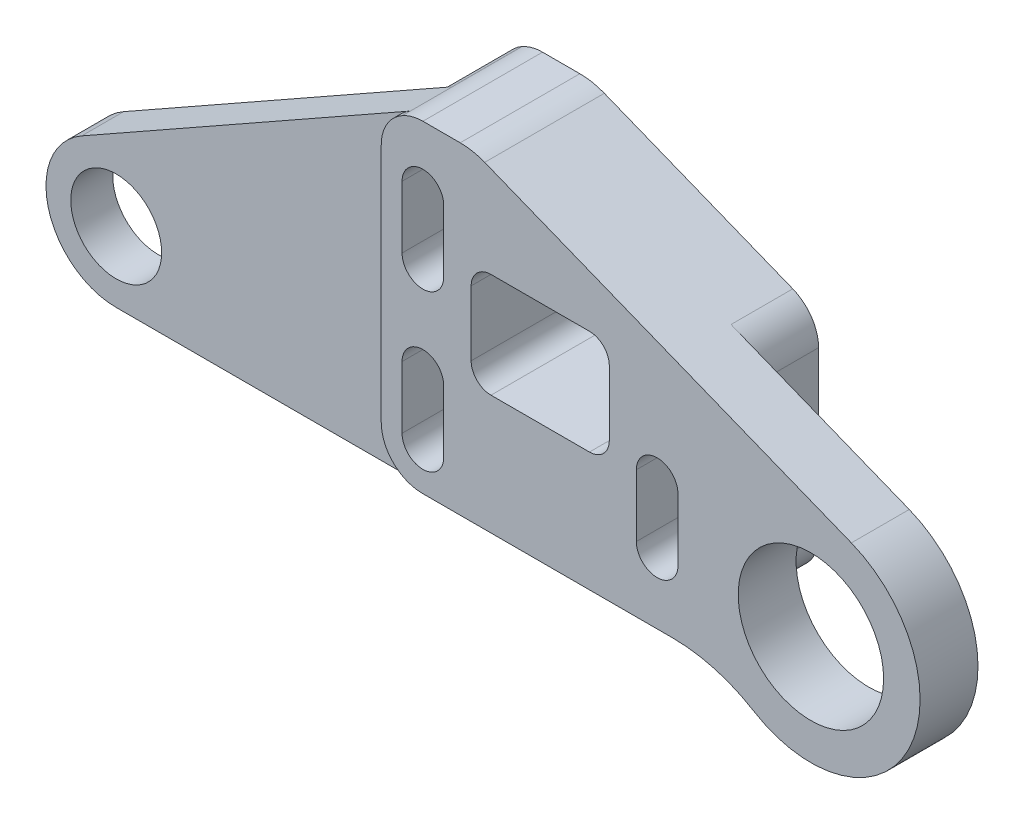
from build123d import *

# Parameters (mm, degrees)
BASE_EXTRUDE_DEPTH = 22.987
CUT_EXTRUDE1_DEPTH = 1.524
CUT_EXTRUDE2_START = -13.3858
CUT_EXTRUDE2_DEPTH = 13.3858
CUT_EXTRUDE3_DEPTH = 11.8618
SKETCH5_R          = 8.73125
CUT_EXTRUDE4_DEPTH = 165.748162847
SKETCH6_R          = 13.97
CUT_EXTRUDE5_DEPTH = 165.9536267
CUT_EXTRUDE6_DEPTH = 165.9536267


with BuildPart() as part:
    # Sketch1 → Base-Extrude (new body)
    with BuildSketch(Plane.XY):
        with BuildLine():
            Line((67.622164121, 48.488607139), (60.451998121, 48.488607139))
            ThreePointArc((60.451998121, 48.488607139), (58.415767784, 48.225162891), (56.513628913, 47.45217869))
            Line((56.513628913, 47.45217869), (-6.63896207, 11.740278591))
            ThreePointArc((-6.63896207, 11.740278591), (-13.04330848, -3.432500932), (0, -13.4874))
            Line((0, -13.4874), (108.3963288, -13.4874))
            ThreePointArc((108.3963288, -13.4874), (116.52844195, -14.610715729), (124.051506942, -17.896533077))
            ThreePointArc((124.051506942, -17.896533077), (153.760306668, -9.394598854), (142.773406597, 19.487639521))
            Line((142.773406597, 19.487639521), (72.327100379, 47.584944713))
            ThreePointArc((72.327100379, 47.584944713), (70.017630202, 48.26064561), (67.622164121, 48.488607139))
        make_face()
    extrude(amount=BASE_EXTRUDE_DEPTH)

    # Sketch2 → Cut-Extrude1 (cut)
    with BuildSketch(Plane.XY.offset(22.987)):
        with BuildLine():
            Line((52.451, 40.561691476), (52.451, -5.6134))
            ThreePointArc((52.451, -5.6134), (54.757241386, -11.181158976), (60.325000513, -13.4874))
            Line((60.325000513, -13.4874), (60.325000513, -28.150605259))
            Line((60.325000513, -28.150605259), (-23.486257356, -28.150605259))
            Line((-23.486257356, -28.150605259), (-22.173444803, 52.159193632))
            Line((-22.173444803, 52.159193632), (56.513628913, 52.159193632))
            Line((56.513628913, 52.159193632), (56.513628913, 47.45217869))
            Line((56.513628913, 47.45217869), (56.449146437, 47.415714759))
            ThreePointArc((56.449146437, 47.415714759), (53.523590332, 44.529146898), (52.451, 40.561691476))
        make_face()
    extrude(amount=-CUT_EXTRUDE1_DEPTH, mode=Mode.SUBTRACT)

    # Sketch3 → Cut-Extrude2 (cut)
    with BuildSketch(Plane(origin=(0, 0, 0), x_dir=(-1, 0, 0), z_dir=(0, 0, -1)).offset(CUT_EXTRUDE2_START)):
        with BuildLine():
            Line((-52.451, 40.561691476), (-52.451, -5.6134))
            ThreePointArc((-52.451, -5.6134), (-54.757241386, -11.181158976), (-60.325000513, -13.4874))
            Line((-60.325000513, -13.4874), (-60.325000513, -35.585726692))
            Line((-60.325000513, -35.585726692), (18.461929403, -35.585726692))
            Line((18.461929403, -35.585726692), (18.461929403, 62.437610527))
            Line((18.461929403, 62.437610527), (-56.449146437, 62.437610527))
            Line((-56.449146437, 62.437610527), (-56.449146437, 47.415714759))
            ThreePointArc((-56.449146437, 47.415714759), (-53.523590332, 44.529146898), (-52.451, 40.561691476))
        make_face()
    extrude(amount=CUT_EXTRUDE2_DEPTH, mode=Mode.SUBTRACT)

    # Sketch4 → Cut-Extrude3 (cut)
    with BuildSketch(Plane(origin=(0, 0, 0), x_dir=(-1, 0, 0), z_dir=(0, 0, -1))):
        with BuildLine():
            Line((-113.4872, -5.6134), (-113.4872, 25.831689784))
            ThreePointArc((-113.4872, 25.831689784), (-112.131206016, 30.249321907), (-108.530259798, 33.145419212))
            Line((-108.530259798, 33.145419212), (-119.346107198, 60.263197686))
            Line((-119.346107198, 60.263197686), (-162.925004358, 60.263197686))
            Line((-162.925004358, 60.263197686), (-162.925004358, -25.739632552))
            Line((-162.925004358, -25.739632552), (-105.6132, -25.739632552))
            Line((-105.6132, -25.739632552), (-105.6132, -13.4874))
            ThreePointArc((-105.6132, -13.4874), (-111.180958795, -11.181158795), (-113.4872, -5.6134))
        make_face()
    extrude(amount=-CUT_EXTRUDE3_DEPTH, mode=Mode.SUBTRACT)

    # Sketch5 → Cut-Extrude4 (cut, through all)
    with BuildSketch(Plane.XY.offset(21.463)):
        Circle(SKETCH5_R)
    extrude(amount=-CUT_EXTRUDE4_DEPTH, mode=Mode.SUBTRACT)

    # Sketch6 → Cut-Extrude5 (cut, through all)
    with BuildSketch(Plane.XY.offset(22.987)):
        with Locations((135.000853225, 8.827e-05)):
            Circle(SKETCH6_R)
    extrude(amount=-CUT_EXTRUDE5_DEPTH, mode=Mode.SUBTRACT)

    # Sketch7 → Cut-Extrude6 (cut, through all)
    with BuildSketch(Plane.XY.offset(22.987)):
        with BuildLine():
            Line((64.4525, -5.4356), (64.4525, 6.5024))
            ThreePointArc((64.4525, 6.5024), (60.452, 10.5029), (56.4515, 6.5024))
            Line((56.4515, 6.5024), (56.4515, -5.4356))
            ThreePointArc((56.4515, -5.4356), (60.452, -9.4361), (64.4525, -5.4356))
        make_face()
        with BuildLine():
            Line((64.4525, 24.5618), (64.4525, 36.4998))
            ThreePointArc((64.4525, 36.4998), (60.452, 40.5003), (56.4515, 36.4998))
            Line((56.4515, 36.4998), (56.4515, 24.5618))
            ThreePointArc((56.4515, 24.5618), (60.452, 20.5613), (64.4525, 24.5618))
        make_face()
        with BuildLine():
            Line((101.4603, 10.9982), (101.4603, -0.9398))
            ThreePointArc((101.4603, -0.9398), (105.4608, -4.9403), (109.4613, -0.9398))
            Line((109.4613, -0.9398), (109.4613, 10.9982))
            ThreePointArc((109.4613, 10.9982), (105.4608, 14.9987), (101.4603, 10.9982))
        make_face()
        with BuildLine():
            Line((73.533, 29.5402), (92.456, 29.5402))
            ThreePointArc((92.456, 29.5402), (95.150076836, 28.424276836), (96.266, 25.7302))
            Line((96.266, 25.7302), (96.266, 13.2588))
            ThreePointArc((96.266, 13.2588), (95.150076836, 10.564723164), (92.456, 9.4488))
            Line((92.456, 9.4488), (73.533, 9.4488))
            ThreePointArc((73.533, 9.4488), (70.838923164, 10.564723164), (69.723, 13.2588))
            Line((69.723, 13.2588), (69.723, 25.7302))
            ThreePointArc((69.723, 25.7302), (70.838923164, 28.424276836), (73.533, 29.5402))
        make_face()
    extrude(amount=-CUT_EXTRUDE6_DEPTH, mode=Mode.SUBTRACT)


solid = part.part
